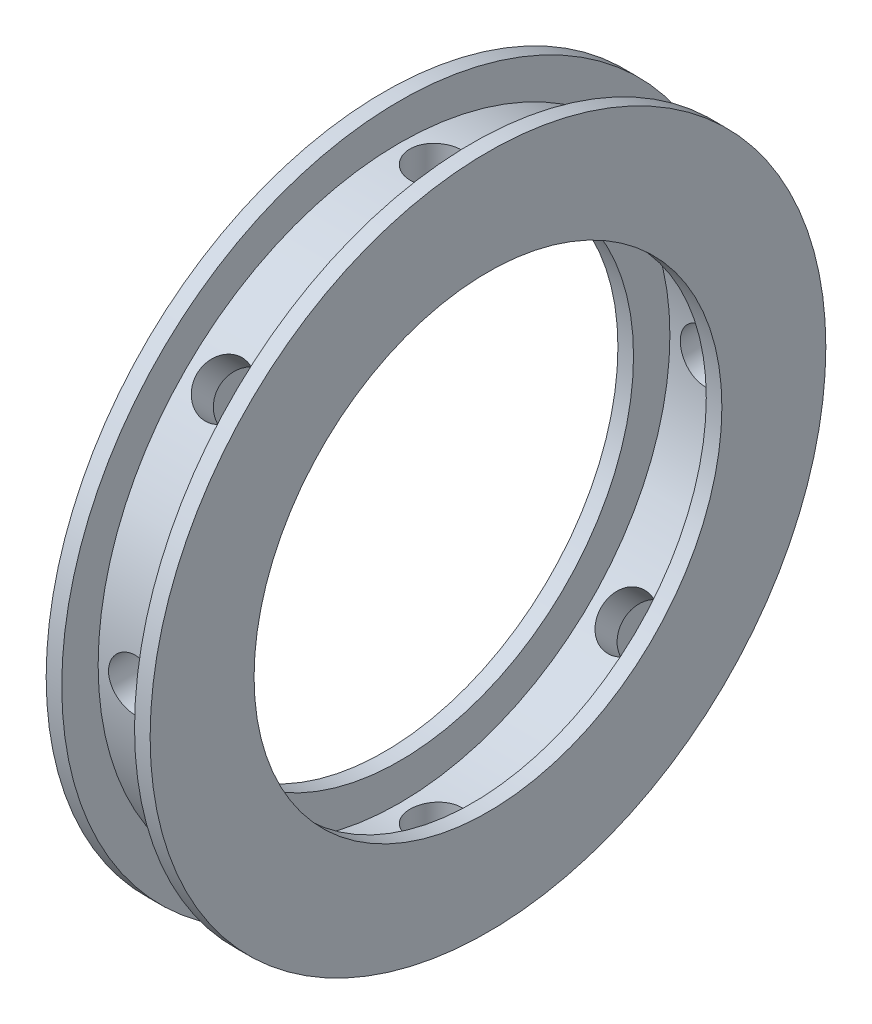
from build123d import *

# Parameters (mm, degrees)
SKETCH2_R          = 2.5
CUT_EXTRUDE1_DEPTH = 48.037219306
CIRPATTERN1_COUNT  = 8


with BuildPart() as part:
    # Sketch1 → Revolve1 (revolve)
    with BuildSketch(Plane.XY, mode=Mode.PRIVATE) as revolve1_sk:
        Polygon((0, 32.5), (0, 22.5), (1.5, 22.5), (1.5, 26), (8.5, 26), (8.5, 22.5), (10, 22.5), (10, 32.5), (8.5, 32.5), (8.5, 29), (1.5, 29), (1.5, 32.5), align=None)
    revolve(revolve1_sk.sketch.rotate(Axis((0, 0, 0), (1, 0, 0)), 90), axis=Axis((0, 0, 0), (1, 0, 0)))

    # Sketch2 → Cut-Extrude1 (cut, through all)
    with BuildSketch(Plane(origin=(0, 0, 0), x_dir=(1, 0, 0), z_dir=(0, 1, 0))):
        with Locations(Location((5, 0, 0), (0, 0, 270))):
            Circle(SKETCH2_R)
    cut_extrude1 = extrude(amount=-CUT_EXTRUDE1_DEPTH, mode=Mode.SUBTRACT)

    # CirPattern1: Cut-Extrude1 ×8 about axis
    cirpattern1_axis = Axis((0, 0, 0), (-1, 0, 0))
    for i in range(1, CIRPATTERN1_COUNT):
        add(cut_extrude1.rotate(cirpattern1_axis, i * 360 / CIRPATTERN1_COUNT), mode=Mode.SUBTRACT)


solid = part.part
